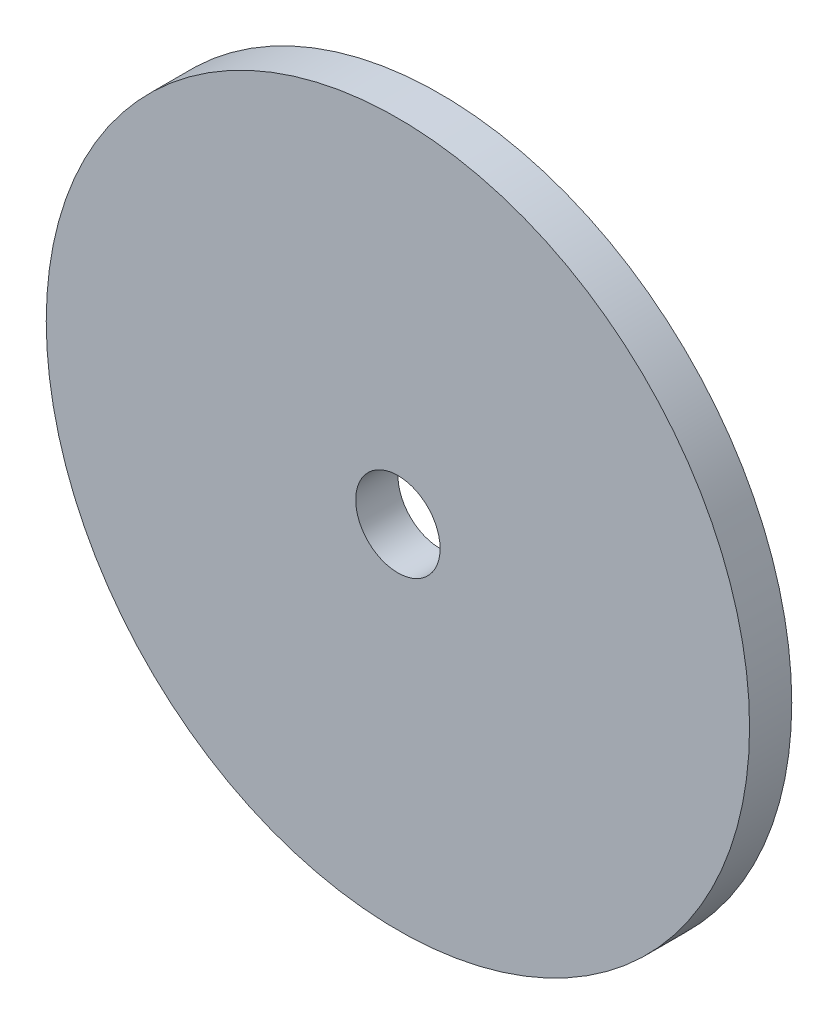
from build123d import *

# Parameters (mm, degrees)
SKETCH1_R           = 50
SKETCH1_R_2         = 6
BOSS_EXTRUDE1_DEPTH = 6


with BuildPart() as part:
    # Sketch1 → Boss-Extrude1 (new body)
    with BuildSketch(Plane.XY):
        Circle(SKETCH1_R)
        Circle(SKETCH1_R_2, mode=Mode.SUBTRACT)
    extrude(amount=BOSS_EXTRUDE1_DEPTH)


solid = part.part
